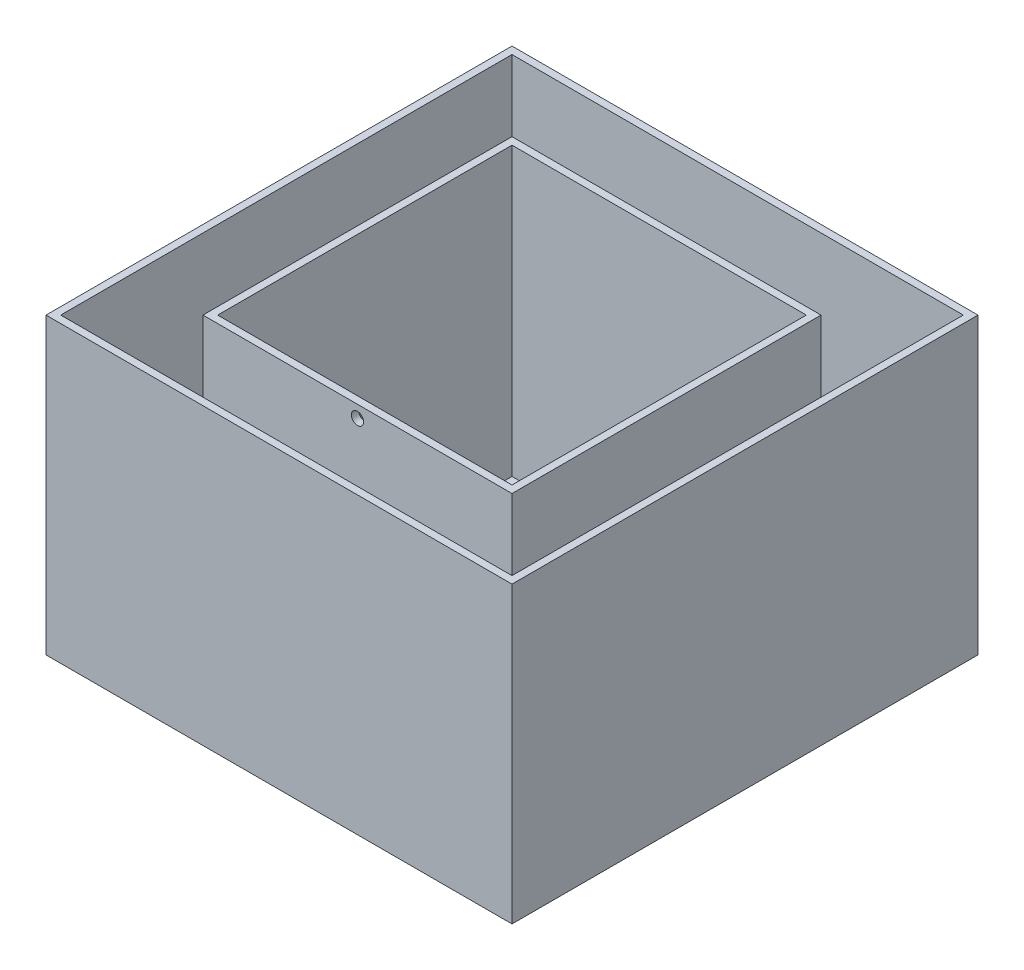
from build123d import *

# Parameters (mm, degrees)
SKETCH1_W           = 190
SKETCH1_H           = 190
BOSS_EXTRUDE1_DEPTH = 120
SKETCH2_W           = 120
SKETCH2_H           = 120
CUT_EXTRUDE1_DEPTH  = 117
SKETCH3_W           = 184
SKETCH3_H           = 184
SKETCH3_W_2         = 126
SKETCH3_H_2         = 126
CUT_EXTRUDE2_DEPTH  = 115
CUT_EXTRUDE3_DEPTH  = 53
SKETCH5_R           = 2.5
CUT_EXTRUDE4_DEPTH  = 17


with BuildPart() as part:
    # Sketch1 → Boss-Extrude1 (new body)
    with BuildSketch(Plane(origin=(0, 0, 0), x_dir=(1, 0, 0), z_dir=(0, 1, 0))):
        Rectangle(SKETCH1_W, SKETCH1_H)
    extrude(amount=BOSS_EXTRUDE1_DEPTH)

    # Sketch2 → Cut-Extrude1 (cut)
    with BuildSketch(Plane(origin=(0, 120, 0), x_dir=(1, 0, 0), z_dir=(0, 1, 0))):
        Rectangle(SKETCH2_W, SKETCH2_H)
    extrude(amount=-CUT_EXTRUDE1_DEPTH, mode=Mode.SUBTRACT)

    # Sketch3 → Cut-Extrude2 (cut)
    with BuildSketch(Plane(origin=(0, 120, 0), x_dir=(1, 0, 0), z_dir=(0, 1, 0))):
        Rectangle(SKETCH3_W, SKETCH3_H)
        Rectangle(SKETCH3_W_2, SKETCH3_H_2, mode=Mode.SUBTRACT)
    extrude(amount=-CUT_EXTRUDE2_DEPTH, mode=Mode.SUBTRACT)

    # Sketch4 → Cut-Extrude3 (cut)
    with BuildSketch(Plane(origin=(0, 5, 0), x_dir=(1, 0, 0), z_dir=(0, 1, 0))):
        Polygon((-89, -89), (-89, 89), (-63, 63), (-63, -63), align=None)
        Polygon((89, -89), (63, -63), (63, 63), (89, 89), align=None)
    extrude(amount=-CUT_EXTRUDE3_DEPTH, mode=Mode.SUBTRACT)

    # Sketch5 → Cut-Extrude4 (cut)
    with BuildSketch(Plane.XY.offset(63)):
        with Locations((0, 115)):
            Circle(SKETCH5_R)
    extrude(amount=-CUT_EXTRUDE4_DEPTH, mode=Mode.SUBTRACT)


solid = part.part
